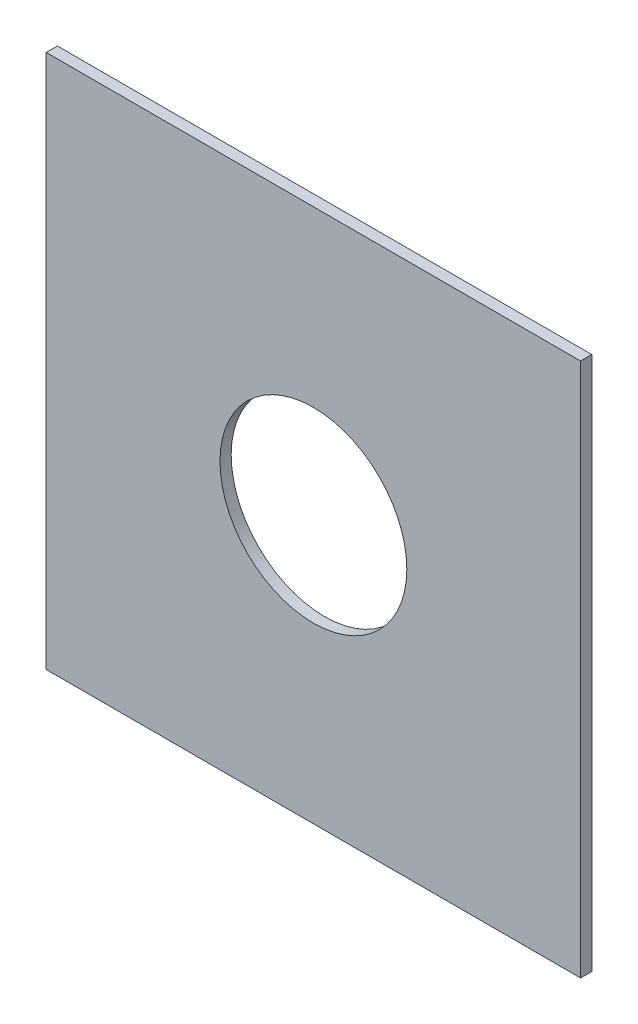
from build123d import *

# Parameters (mm, degrees)
SKETCH1_W           = 143
SKETCH1_H           = 143
SKETCH1_R           = 25
BOSS_EXTRUDE1_DEPTH = 3


with BuildPart() as part:
    # Sketch1 → Boss-Extrude1 (new body)
    with BuildSketch(Plane.XY):
        Rectangle(SKETCH1_W, SKETCH1_H)
        Circle(SKETCH1_R, mode=Mode.SUBTRACT)
    extrude(amount=BOSS_EXTRUDE1_DEPTH)


solid = part.part
